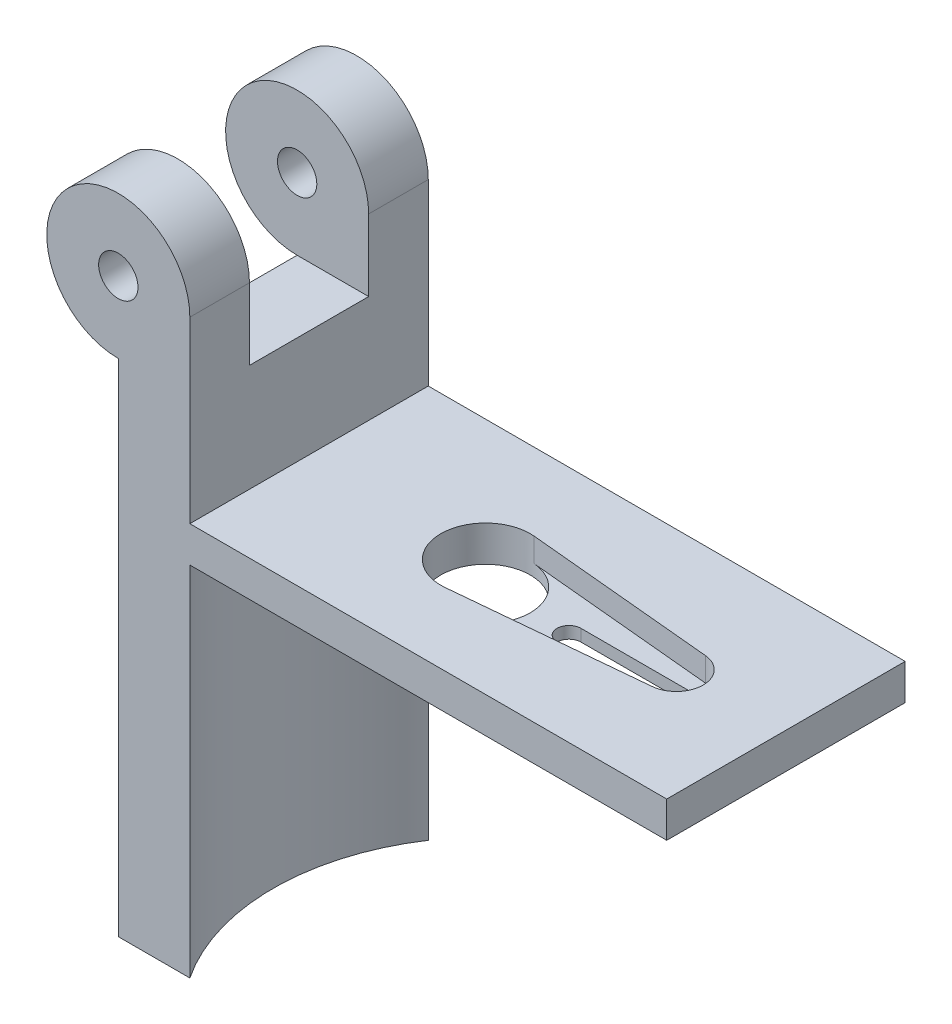
from build123d import *

# Parameters (mm, degrees)
SKETCH_1_W          = 40
SKETCH_1_H          = 3
EXTRUDE_1_DEPTH     = 20
SKETCH_2_R          = 2.25
CUT_EXTRUDE_1_DEPTH = 2
SKETCH_3_R          = 3.75
CUT_EXTRUDE_2_DEPTH = 3
CUT_EXTRUDE_3_DEPTH = 3
SKETCH_5_W          = 10
SKETCH_5_H          = 12
CUT_EXTRUDE_4_DEPTH = 12
CUT_EXTRUDE_5_DEPTH = 30


with BuildPart() as part:
    # 草图1 → 凸台-拉伸1 (new body)
    with BuildSketch(Plane.XY):
        with BuildLine():
            ThreePointArc((0, -1.65), (-1.166726189, 1.166726189), (1.65, 0))
            Line((1.65, 0), (6, 0))
            ThreePointArc((6, 0), (-4.242640687, 4.242640687), (0, -6))
            Line((0, -6), (0, -1.65))
        make_face()
        with BuildLine():
            Line((6, 0), (1.65, 0))
            ThreePointArc((1.65, 0), (1.166726189, -1.166726189), (0, -1.65))
            Line((0, -1.65), (0, -6))
            ThreePointArc((0, -6), (4.242640687, -4.242640687), (6, 0))
        make_face()
        with BuildLine():
            Line((6, -15), (6, 0))
            ThreePointArc((6, 0), (4.242640687, -4.242640687), (0, -6))
            Line((0, -6), (0, -48))
            Line((0, -48), (6, -48))
            Line((6, -48), (6, -18))
            Line((6, -18), (6, -15))
        make_face()
        with Locations((26, -16.5)):
            Rectangle(SKETCH_1_W, SKETCH_1_H)
    extrude(amount=EXTRUDE_1_DEPTH)

    # 草图2 → 切除-拉伸1 (cut)
    with BuildSketch(Plane(origin=(0, -15, 0), x_dir=(1, 0, 0), z_dir=(0, 1, 0))):
        with BuildLine():
            ThreePointArc((37.2109375, -12.436802432), (34.75, -10.196711949), (37.2109375, -7.956621466))
            Line((37.2109375, -7.956621466), (21.3515625, -6.463227811))
            ThreePointArc((21.3515625, -6.463227811), (23.773162398, -7.672415946), (24.75, -10.196711949))
            ThreePointArc((24.75, -10.196711949), (23.773162398, -12.721007952), (21.3515625, -13.930196087))
            Line((21.3515625, -13.930196087), (37.2109375, -12.436802432))
        make_face()
        with Locations((37, -10.196711949)):
            Circle(SKETCH_2_R)
    extrude(amount=-CUT_EXTRUDE_1_DEPTH, mode=Mode.SUBTRACT)

    # 草图3 → 切除-拉伸2 (cut)
    with BuildSketch(Plane(origin=(0, -15, 0), x_dir=(1, 0, 0), z_dir=(0, 1, 0))):
        with Locations(Location((21, -10.196711949, 0), (0, 0, 180))):
            Circle(SKETCH_3_R)
    extrude(amount=-CUT_EXTRUDE_2_DEPTH, mode=Mode.SUBTRACT)

    # 草图4 → 切除-拉伸3 (cut)
    with BuildSketch(Plane(origin=(0, -17, 0), x_dir=(1, 0, 0), z_dir=(0, 1, 0))):
        with BuildLine():
            Line((28, -9.196711949), (37, -9.196711949))
            ThreePointArc((37, -9.196711949), (38, -10.196711949), (37, -11.196711949))
            Line((37, -11.196711949), (28, -11.196711949))
            ThreePointArc((28, -11.196711949), (27, -10.196711949), (28, -9.196711949))
        make_face()
    extrude(amount=-CUT_EXTRUDE_3_DEPTH, mode=Mode.SUBTRACT)

    # 草图5 → 切除-拉伸4 (cut)
    with BuildSketch(Plane(origin=(6, 0, 0), x_dir=(0, 0, -1), z_dir=(1, 0, 0))):
        with Locations((-10, 0)):
            Rectangle(SKETCH_5_W, SKETCH_5_H)
    extrude(amount=-CUT_EXTRUDE_4_DEPTH, mode=Mode.SUBTRACT)

    # 草图6 → 切除-拉伸5 (cut)
    with BuildSketch(Plane.XZ.offset(48)):
        with BuildLine():
            Line((6, 20), (6, 0))
            ThreePointArc((6, 0), (2.981888497, 10), (6, 20))
        make_face()
    extrude(amount=-CUT_EXTRUDE_5_DEPTH, mode=Mode.SUBTRACT)


solid = part.part
